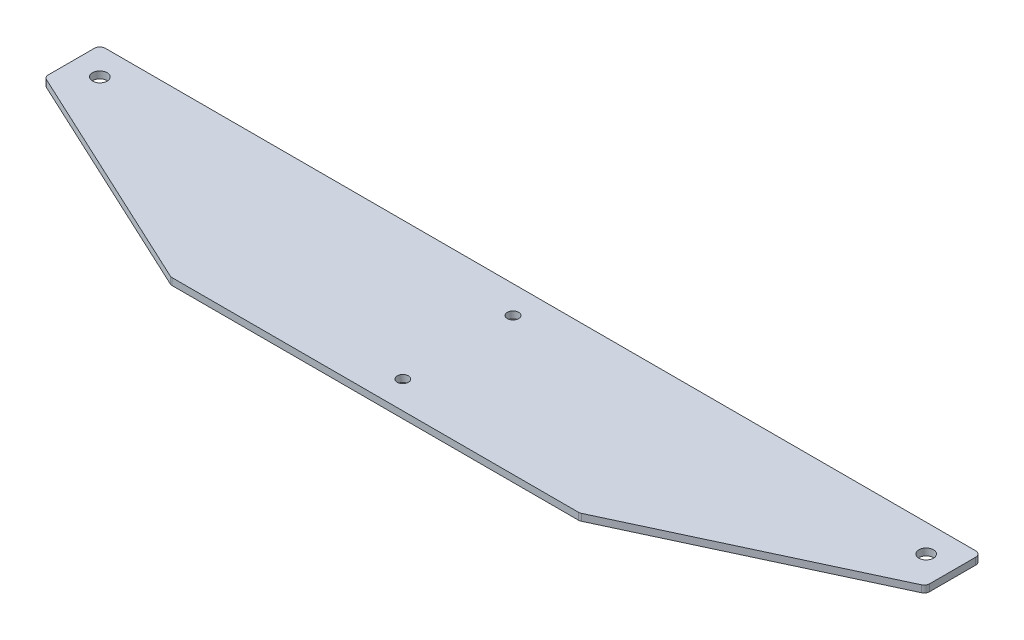
from build123d import *

# Parameters (mm, degrees)
SKETCH1_W           = 406.4
SKETCH1_H           = 76.2
SKETCH1_R           = 3.3734375
SKETCH1_R_2         = 2.5796875
BOSS_EXTRUDE1_DEPTH = 3.175
CHAMFER1_SIZE       = 50.8
CHAMFER1_SIZE2      = 108.940951562
CHAMFER2_SIZE       = 50.8
CHAMFER2_SIZE2      = 108.940951562
FILLET1_R           = 2.54


with BuildPart() as part:
    # Sketch1 → Boss-Extrude1 (new body)
    with BuildSketch(Plane(origin=(0, 0, 0), x_dir=(1, 0, 0), z_dir=(0, 1, 0))):
        Rectangle(SKETCH1_W, SKETCH1_H)
        with Locations(Location((-190.5, 25.4, 0), (0, 0, 270))):
            Circle(SKETCH1_R, mode=Mode.SUBTRACT)
        with Locations(Location((190.5, 25.4, 0), (0, 0, 270))):
            Circle(SKETCH1_R, mode=Mode.SUBTRACT)
        with Locations(Location((0, 25.4, 0), (0, 0, 270))):
            Circle(SKETCH1_R_2, mode=Mode.SUBTRACT)
        with Locations(Location((0, -25.4, 0), (0, 0, 270))):
            Circle(SKETCH1_R_2, mode=Mode.SUBTRACT)
    extrude(amount=BOSS_EXTRUDE1_DEPTH)

    # Chamfer1
    chamfer1_edges = [part.edges().sort_by_distance(p)[0] for p in [
        (-203.2, 1.5875, 38.1),
    ]]
    chamfer1_side = [part.faces().sort_by_distance(p)[0] for p in [
        (-203.2, 1.5875, 0),
    ]]
    chamfer(chamfer1_edges, length=CHAMFER1_SIZE, length2=CHAMFER1_SIZE2, reference=chamfer1_side[0])

    # Chamfer2
    chamfer2_edges = [part.edges().sort_by_distance(p)[0] for p in [
        (203.2, 1.5875, 38.1),
    ]]
    chamfer2_side = [part.faces().sort_by_distance(p)[0] for p in [
        (203.2, 1.5875, 0),
    ]]
    chamfer(chamfer2_edges, length=CHAMFER2_SIZE, length2=CHAMFER2_SIZE2, reference=chamfer2_side[0])

    # Fillet1
    fillet1_edges = [part.edges().sort_by_distance(p)[0] for p in [
        (-94.259048438, 1.5875, 38.1),
        (-203.2, 1.5875, -12.7),
        (203.2, 1.5875, -12.7),
        (94.259048438, 1.5875, 38.1),
        (-203.2, 1.5875, -38.1),
        (203.2, 1.5875, -38.1),
    ]]
    fillet(fillet1_edges, radius=FILLET1_R)


solid = part.part
